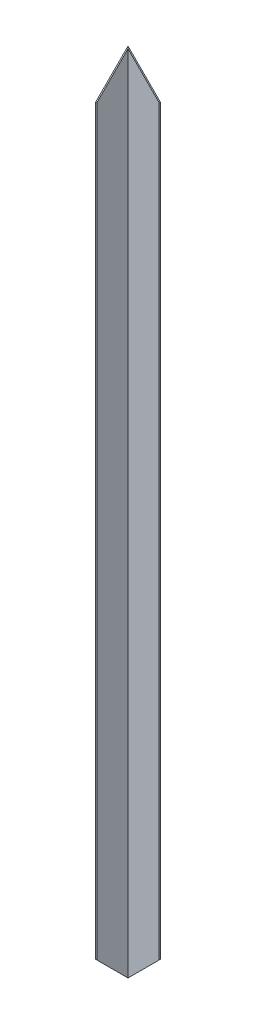
from build123d import *

# Parameters (mm, degrees)
AUFSATZ_LINEAR_AUSTRAGEN1_DEPTH      = 499.9
AUFSATZ_LINEAR_AUSTRAGEN1_DEPTH_BACK = 499.9
SCHNITT_LINEAR_AUSTRAGEN1_DEPTH      = 1.5
SCHNITT_LINEAR_AUSTRAGEN2_DEPTH      = 1.5


with BuildPart() as part:
    # Skizze1 → Aufsatz-Linear austragen1 (new, two sides: drawn at the far end of the back side and taken through both)
    with BuildSketch(Plane(origin=(0, 0, 0), x_dir=(1, 0, 0), z_dir=(0, 1, 0)).offset(-AUFSATZ_LINEAR_AUSTRAGEN1_DEPTH_BACK)):
        Polygon((-461.5, 4), (-461.5, 5.5), (-501.5, 5.5), (-501.5, -34.5), (-500, -34.5), (-500, 4), align=None)
    extrude(amount=AUFSATZ_LINEAR_AUSTRAGEN1_DEPTH + AUFSATZ_LINEAR_AUSTRAGEN1_DEPTH_BACK)

    # Skizze2 → Schnitt-Linear austragen1 (cut)
    with BuildSketch(Plane(origin=(0, 0, -5.5), x_dir=(-1, 0, 0), z_dir=(0, 0, -1))):
        Polygon((501.5, 499.9), (461.5, 459.9), (461.5, 499.9), align=None)
        Polygon((461.5, -459.9), (461.5, -499.9), (501.5, -499.9), align=None)
    extrude(amount=-SCHNITT_LINEAR_AUSTRAGEN1_DEPTH, mode=Mode.SUBTRACT)

    # Skizze3 → Schnitt-Linear austragen2 (cut)
    with BuildSketch(Plane.ZY.offset(501.5)):
        Polygon((34.5, 499.9), (-5.5, 499.9), (34.5, 459.9), align=None)
        Polygon((-5.5, -499.9), (34.5, -459.9), (34.5, -499.9), align=None)
    extrude(amount=-SCHNITT_LINEAR_AUSTRAGEN2_DEPTH, mode=Mode.SUBTRACT)


solid = part.part
